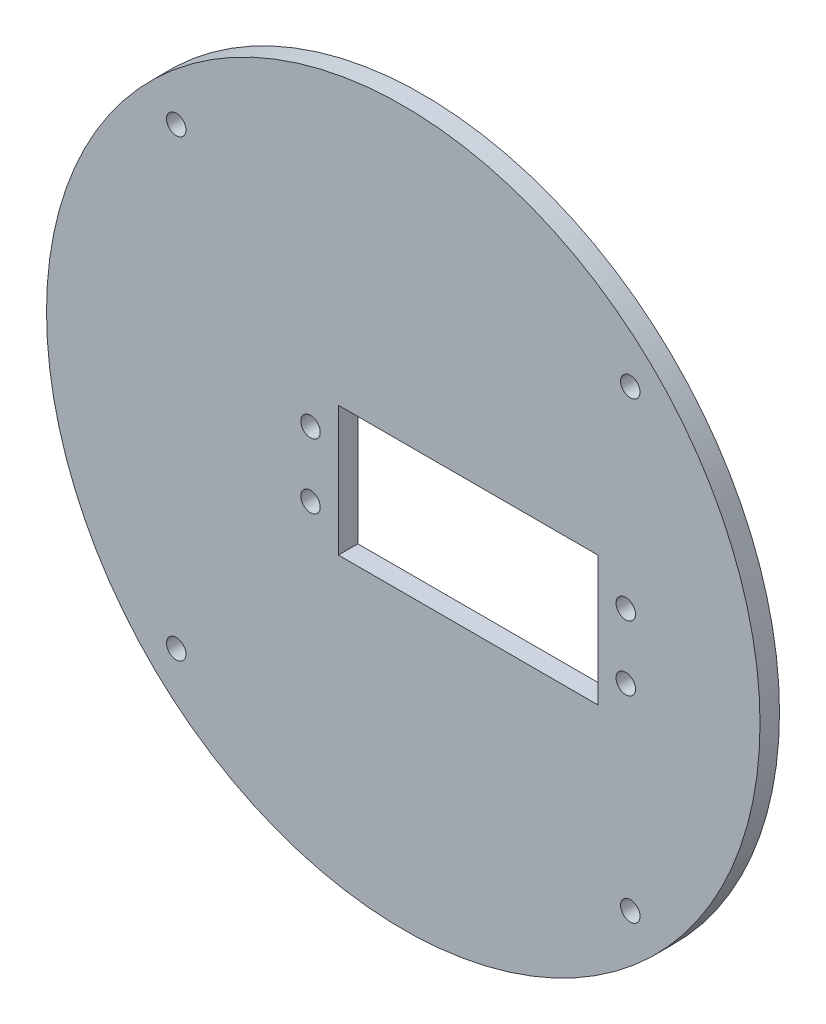
from build123d import *

# Parameters (mm, degrees)
SKETCH_1_R      = 55
SKETCH_1_R_2    = 1.5
SKETCH_1_W      = 40
SKETCH_1_H      = 20
EXTRUDE_2_DEPTH = 3


with BuildPart() as part:
    # 草图1 → 凸台-拉伸2 (new body)
    with BuildSketch(Plane.XY):
        Circle(SKETCH_1_R)
        with Locations((-35, 35)):
            Circle(SKETCH_1_R_2, mode=Mode.SUBTRACT)
        with Locations((35, 35)):
            Circle(SKETCH_1_R_2, mode=Mode.SUBTRACT)
        with Locations((35, -35)):
            Circle(SKETCH_1_R_2, mode=Mode.SUBTRACT)
        with Locations((-35, -35)):
            Circle(SKETCH_1_R_2, mode=Mode.SUBTRACT)
        with Locations((-14.3, 5)):
            Circle(SKETCH_1_R_2, mode=Mode.SUBTRACT)
        with Locations((-14.3, -5)):
            Circle(SKETCH_1_R_2, mode=Mode.SUBTRACT)
        with Locations((34.3, 5)):
            Circle(SKETCH_1_R_2, mode=Mode.SUBTRACT)
        with Locations((34.3, -5)):
            Circle(SKETCH_1_R_2, mode=Mode.SUBTRACT)
        with Locations((10, 0)):
            Rectangle(SKETCH_1_W, SKETCH_1_H, mode=Mode.SUBTRACT)
    extrude(amount=EXTRUDE_2_DEPTH)


solid = part.part
